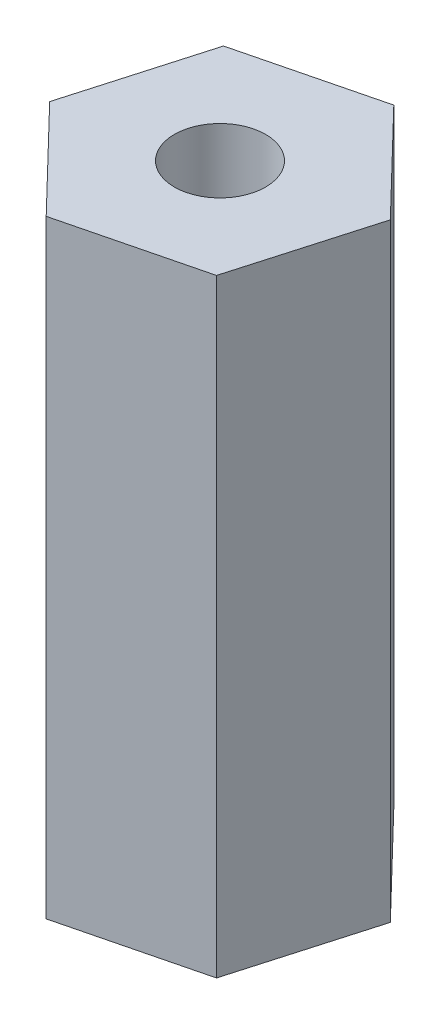
from build123d import *

# Parameters (mm, degrees)
RESSALTO_EXTRUS_O1_DEPTH = 20
ESBO_O2_R                = 1.5
CORTE_EXTRUS_O1_DEPTH    = 30


with BuildPart() as part:
    # Esboço1 → Ressalto-extrusão1 (new body)
    with BuildSketch(Plane(origin=(0, 0, 0), x_dir=(1, 0, 0), z_dir=(0, 1, 0))):
        Polygon((3.208194636, -3.322773016), (4.48170316, 1.116991547), (1.273508525, 4.439764563), (-3.208194636, 3.322773016), (-4.48170316, -1.116991547), (-1.273508525, -4.439764563), align=None)
    extrude(amount=RESSALTO_EXTRUS_O1_DEPTH)

    # Esboço2 → Corte-extrusão1 (cut)
    with BuildSketch(Plane.XZ):
        with Locations(Location((0, 0, 0), (0, 0, 270))):
            Circle(ESBO_O2_R)
    extrude(amount=-CORTE_EXTRUS_O1_DEPTH, mode=Mode.SUBTRACT)


solid = part.part
